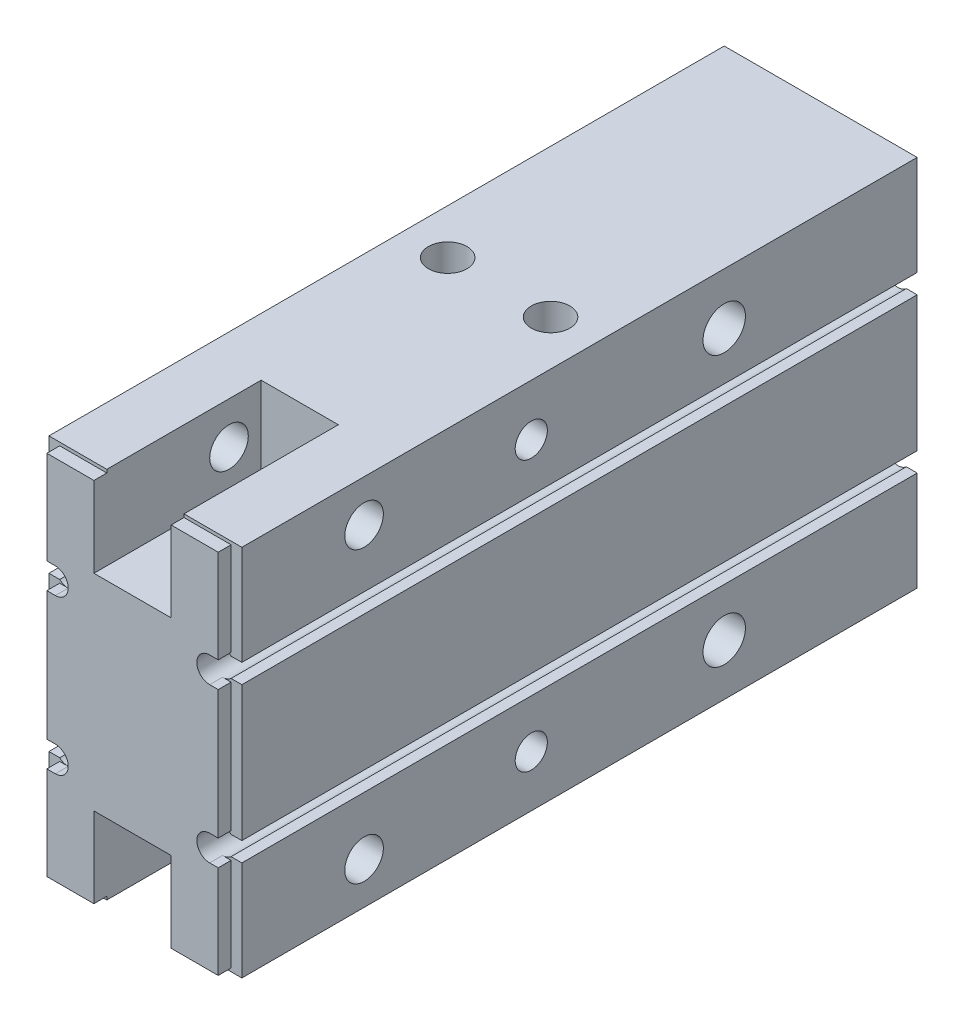
from build123d import *
from build123d.topology import SkipClean

# Parameters (mm, degrees)
BODY_DEPTH                       = 105
SKETCH4_R                        = 3.3
THROUGHHOLES_DEPTH               = 113.986724884
SKETCH10_R                       = 3
FINGERPIVOTHOLES_DEPTH           = 113.986724884
POSITIONINGPINHOLE_DEPTH         = 4
M6_X_1_0_BACKHOLE1_SIZE_25_D     = 6
M6_X_1_0_BACKHOLE1_SIZE_25_DEPTH = 12
M6_X_1_0_BACKHOLE1_SIZE_25_TIP   = 1.802581857
M6_X_1_0_BACKHOLE2_SIZE_25_D     = 6
M6_X_1_0_BACKHOLE2_SIZE_25_DEPTH = 12
M6_X_1_0_BACKHOLE2_SIZE_25_TIP   = 1.802581857
M5_X_0_8_PORT_1_D                = 5
M5_X_0_8_PORT_1_DEPTH            = 5
M5_X_0_8_PORT_1_TIP              = 1.502151548
M5_X_0_8_PORT_2_D                = 5
M5_X_0_8_PORT_2_DEPTH            = 7.5
M5_X_0_8_PORT_2_TIP              = 1.502151548
EDGEPLATE_DEPTH                  = 2
SKETCH58_W                       = 12
SKETCH58_H                       = 13
FINGERCUTOUT1_DEPTH              = 26
SKETCH59_W                       = 14
SKETCH59_H                       = 14
FINGERGAP_DEPTH                  = 12
SKETCH60_R                       = 13
CUT_EXTRUDE1_DEPTH               = 1.5


with BuildPart() as part:
    # Sketch1 → Body (new body)
    with BuildSketch(Plane.XY):
        with BuildLine():
            Line((-15, 29), (15, 29))
            Line((15, 29), (15, 13.5))
            Line((15, 13.5), (13.322875656, 13.5))
            ThreePointArc((13.322875656, 13.5), (10, 12), (13.322875656, 10.5))
            Line((13.322875656, 10.5), (15, 10.5))
            Line((15, 10.5), (15, -10.5))
            Line((15, -10.5), (13.322875656, -10.5))
            ThreePointArc((13.322875656, -10.5), (10, -12), (13.322875656, -13.5))
            Line((13.322875656, -13.5), (15, -13.5))
            Line((15, -13.5), (15, -29))
            Line((15, -29), (-15, -29))
            Line((-15, -29), (-15, -13.5))
            Line((-15, -13.5), (-13.322875656, -13.5))
            ThreePointArc((-13.322875656, -13.5), (-10, -12), (-13.322875656, -10.5))
            Line((-13.322875656, -10.5), (-15, -10.5))
            Line((-15, -10.5), (-15, 10.5))
            Line((-15, 10.5), (-13.322875656, 10.5))
            ThreePointArc((-13.322875656, 10.5), (-10, 12), (-13.322875656, 13.5))
            Line((-13.322875656, 13.5), (-15, 13.5))
            Line((-15, 13.5), (-15, 29))
        make_face()
    extrude(amount=BODY_DEPTH)

    # Sketch4 → ThroughHoles (cut, through all)
    with BuildSketch(Plane(origin=(15, 0, 0), x_dir=(0, 0, -1), z_dir=(1, 0, 0))):
        with Locations(Location((-30, 21, 0), (0, 0, 90))):
            Circle(SKETCH4_R)
        with Locations(Location((-30, -21, 0), (0, 0, 270))):
            Circle(SKETCH4_R)
    extrude(amount=-THROUGHHOLES_DEPTH, mode=Mode.SUBTRACT)

    # Sketch10 → FingerPivotHoles (cut, through all)
    with BuildSketch(Plane(origin=(15, 0, 0), x_dir=(0, 0, -1), z_dir=(1, 0, 0))):
        with Locations(Location((-86, 22.5, 0), (0, 0, 90))):
            Circle(SKETCH10_R)
        with Locations(Location((-86, -22.5, 0), (0, 0, 270))):
            Circle(SKETCH10_R)
    extrude(amount=-FINGERPIVOTHOLES_DEPTH, mode=Mode.SUBTRACT)

    # Sketch17 → PositioningPinHole (cut)
    with BuildSketch(Plane(origin=(0, 0, 0), x_dir=(-1, 0, 0), z_dir=(0, 0, -1))):
        with BuildLine():
            Line((-2, -22.5), (-2, -23.5))
            ThreePointArc((-2, -23.5), (0, -25.5), (2, -23.5))
            Line((2, -23.5), (2, -22.5))
            ThreePointArc((2, -22.5), (0, -20.5), (-2, -22.5))
        make_face()
    extrude(amount=-POSITIONINGPINHOLE_DEPTH, mode=Mode.SUBTRACT)

    # Sketch35 → M6 x 1.0 #1(Size=25) (revolve, cut)
    with BuildSketch(Plane(origin=(15, 21, 60), x_dir=(0, 0, -1), z_dir=(0, 1, 0))):
        Polygon((0, 0), (0, 13.502151548), (2.5, 12), (2.5, 0), align=None)
    m6_x_1_0_1_size_25 = revolve(axis=Axis((19.244199587, 21, 60), (-1, 0, 0)), mode=Mode.SUBTRACT)

    # M6 x 1.0 #2(Size=25): M6 x 1.0 #1(Size=25) across plane
    add(m6_x_1_0_1_size_25.mirror(Plane.ZX), mode=Mode.SUBTRACT)

    # M6 x 1.0 Other Side(Size=25): M6 x 1.0 #1(Size=25) across plane
    add(m6_x_1_0_1_size_25.mirror(Plane(origin=(0, 0, 0), x_dir=(0, 0, 1), z_dir=(1, 0, 0))), mode=Mode.SUBTRACT)

    # M6 x 1.0 Other Side(Size=25) copy 1 sketc → M6 x 1.0 Other Side(Size=25) copy 1 (revolve, cut)
    with BuildSketch(Plane(origin=(-15, -21, 60), x_dir=(0, 0, -1), z_dir=(0, -1, 0))):
        Polygon((0, 0), (0, 13.502151548), (2.5, 12), (2.5, 0), align=None)
    revolve(axis=Axis((-19.244199587, -21, 60), (1, 0, 0)), mode=Mode.SUBTRACT)

    # M6 x 1.0 BackHole1(Size=25)
    with Locations(Plane(origin=(-60.737587153, -41.442559387, 0), x_dir=(-1, 0, 0), z_dir=(0, 0, -1))):
        with Locations((-51.737587153, 64.442559387)):
            Hole(M6_X_1_0_BACKHOLE1_SIZE_25_D / 2, depth=M6_X_1_0_BACKHOLE1_SIZE_25_DEPTH)
            with Locations((0, 0, -(M6_X_1_0_BACKHOLE1_SIZE_25_DEPTH + M6_X_1_0_BACKHOLE1_SIZE_25_TIP / 2))):  # 118° drill point
                Cone(0, M6_X_1_0_BACKHOLE1_SIZE_25_D / 2, M6_X_1_0_BACKHOLE1_SIZE_25_TIP, mode=Mode.SUBTRACT)

    # M6 x 1.0 BackHole2(Size=25)
    with Locations(Plane(origin=(-41.945081707, -86.589051762, 0), x_dir=(-1, 0, 0), z_dir=(0, 0, -1))):
        with Locations((-50.945081707, 63.589051762)):
            Hole(M6_X_1_0_BACKHOLE2_SIZE_25_D / 2, depth=M6_X_1_0_BACKHOLE2_SIZE_25_DEPTH)
            with Locations((0, 0, -(M6_X_1_0_BACKHOLE2_SIZE_25_DEPTH + M6_X_1_0_BACKHOLE2_SIZE_25_TIP / 2))):  # 118° drill point
                Cone(0, M6_X_1_0_BACKHOLE2_SIZE_25_D / 2, M6_X_1_0_BACKHOLE2_SIZE_25_TIP, mode=Mode.SUBTRACT)

    # M5 x 0.8 Port #1
    with Locations(Plane(origin=(50.284781511, -29, -56.257532124), x_dir=(1, 0, 0), z_dir=(0, -1, 0))):
        with Locations((-57.284781511, 64.257532124)):
            Hole(M5_X_0_8_PORT_1_D / 2, depth=M5_X_0_8_PORT_1_DEPTH)
            with Locations((0, 0, -(M5_X_0_8_PORT_1_DEPTH + M5_X_0_8_PORT_1_TIP / 2))):  # 118° drill point
                Cone(0, M5_X_0_8_PORT_1_D / 2, M5_X_0_8_PORT_1_TIP, mode=Mode.SUBTRACT)

    # M5 x 0.8 Port #2
    with Locations(Plane(origin=(54.73355918, -29, -22.335602394), x_dir=(1, 0, 0), z_dir=(0, -1, 0))):
        with Locations((-47.73355918, 72.335602394)):
            Hole(M5_X_0_8_PORT_2_D / 2, depth=M5_X_0_8_PORT_2_DEPTH)
            with Locations((0, 0, -(M5_X_0_8_PORT_2_DEPTH + M5_X_0_8_PORT_2_TIP / 2))):  # 118° drill point
                Cone(0, M5_X_0_8_PORT_2_D / 2, M5_X_0_8_PORT_2_TIP, mode=Mode.SUBTRACT)

    # Sketch49 → EdgePlate (add)
    with SkipClean():  # the faces are left unmerged after this step: merging them gives an invalid solid
        with BuildSketch(Plane.XY.offset(105)):
            with BuildLine():
                Line((12, 14), (13.322875656, 14))
                Line((13.322875656, 14), (13.322875656, 28.5))
                Line((13.322875656, 28.5), (-13.322875656, 28.5))
                Line((-13.322875656, 28.5), (-13.322875656, 14))
                Line((-13.322875656, 14), (-12, 14))
                ThreePointArc((-12, 14), (-10, 12), (-12, 10))
                Line((-12, 10), (-13.322875656, 10))
                Line((-13.322875656, 10), (-13.322875656, -10))
                Line((-13.322875656, -10), (-12, -10))
                ThreePointArc((-12, -10), (-10, -12), (-12, -14))
                Line((-12, -14), (-13.322875656, -14))
                Line((-13.322875656, -14), (-13.322875656, -28.5))
                Line((-13.322875656, -28.5), (13.322875656, -28.5))
                Line((13.322875656, -28.5), (13.322875656, -14))
                Line((13.322875656, -14), (12, -14))
                ThreePointArc((12, -14), (10, -12), (12, -10))
                Line((12, -10), (13.322875656, -10))
                Line((13.322875656, -10), (13.322875656, 10))
                Line((13.322875656, 10), (12, 10))
                ThreePointArc((12, 10), (10, 12), (12, 14))
            make_face()
        extrude(amount=EDGEPLATE_DEPTH)

    # Sketch57 → M6 x 1.0 TopHole1(Size=25) (revolve, cut)
    with SkipClean():  # the faces are left unmerged after this step: merging them gives an invalid solid
        with BuildSketch(Plane(origin=(-8, 29, 50), x_dir=(0, 0, 1), z_dir=(1, 0, 0))):
            Polygon((0, 0), (0, 11.802581857), (3, 10), (3, 0), align=None)
        m6_x_1_0_tophole1_size_25 = revolve(axis=Axis((-8, 33.244199587, 50), (0, -1, 0)), mode=Mode.SUBTRACT)

    # M6 x 1.0 TopHole2(Size=25): M6 x 1.0 TopHole1(Size=25) across plane
    with SkipClean():  # the faces are left unmerged after this step: merging them gives an invalid solid
        add(m6_x_1_0_tophole1_size_25.mirror(Plane(origin=(0, 0, 0), x_dir=(0, 0, 1), z_dir=(1, 0, 0))), mode=Mode.SUBTRACT)

    # Sketch58 → FingerCutout1 (cut)
    with SkipClean():  # the faces are left unmerged after this step: merging them gives an invalid solid
        with BuildSketch(Plane.XY.offset(107)):
            with Locations((0, 22.5)):
                Rectangle(SKETCH58_W, SKETCH58_H)
        fingercutout1 = extrude(amount=-FINGERCUTOUT1_DEPTH, mode=Mode.SUBTRACT)

    # FingerCutout2: FingerCutout1 across plane
    with SkipClean():  # the faces are left unmerged after this step: merging them gives an invalid solid
        add(fingercutout1.mirror(Plane.ZX), mode=Mode.SUBTRACT)

    # Sketch59 → FingerGap (cut)
    with SkipClean():  # the faces are left unmerged after this step: merging them gives an invalid solid
        with BuildSketch(Plane(origin=(-6, 0, 0), x_dir=(0, 0, -1), z_dir=(1, 0, 0))):
            with Locations((-88, -9)):
                Rectangle(SKETCH59_W, SKETCH59_H)
            with Locations((-88, 9)):
                Rectangle(SKETCH59_W, SKETCH59_H)
        extrude(amount=FINGERGAP_DEPTH, mode=Mode.SUBTRACT)

    # Sketch60 → Cut-Extrude1 (cut)
    with SkipClean():  # the faces are left unmerged after this step: merging them gives an invalid solid
        with BuildSketch(Plane(origin=(0, 0, 0), x_dir=(-1, 0, 0), z_dir=(0, 0, -1))):
            Circle(SKETCH60_R)
        extrude(amount=-CUT_EXTRUDE1_DEPTH, mode=Mode.SUBTRACT)


solid = part.part
